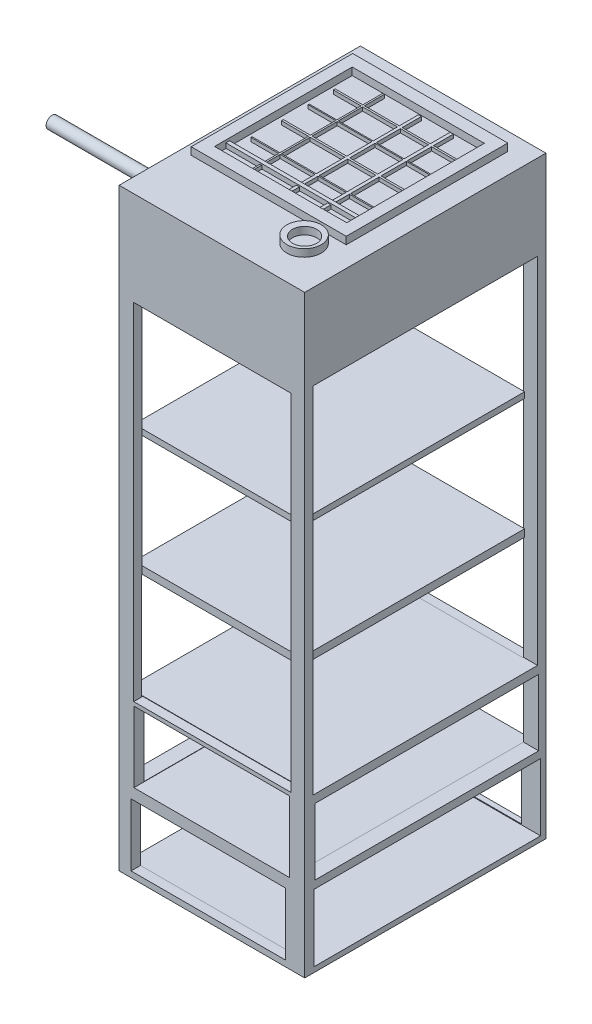
from build123d import *

# Parameters (mm, degrees)
SKETCH1_W            = 65
SKETCH1_H            = 160
SKETCH1_W_2          = 60.528038534
SKETCH1_H_2          = 95.484432758
BOSS_EXTRUDE1_DEPTH  = 50
SKETCH2_W            = 42.326088174
SKETCH2_H            = 93.155548253
CUT_EXTRUDE1_DEPTH   = 122.249667031
BOSS_EXTRUDE2_REACH  = 134.687
SKETCH3_W            = 45.057465339
SKETCH3_H            = 60.150971425
SKETCH4_W            = 60.381733109
SKETCH4_H            = 32.891934871
CUT_EXTRUDE2_DEPTH   = 107.656068998
SKETCH5_W            = 60.382912929
SKETCH5_H            = 30.398575893
CUT_EXTRUDE3_DEPTH   = 106.874612869
SKETCH6_W            = 60.450333047
SKETCH6_H            = 28.299971804
CUT_EXTRUDE4_DEPTH   = 106.874612869
SKETCH7_W            = 60.304182419
SKETCH7_H            = 17.866945613
CUT_EXTRUDE5_DEPTH   = 108.390557105
SKETCH8_W            = 41.938013728
SKETCH8_H            = 19.050379348
CUT_EXTRUDE6_DEPTH   = 122.249667031
SKETCH10_W           = 61.039483095
SKETCH10_H           = 18.053937432
CUT_EXTRUDE10_DEPTH  = 108.390557105
SKETCH11_W           = 41.646222101
SKETCH11_H           = 16.821762484
CUT_EXTRUDE11_DEPTH  = 122.249667031
SKETCH12_W           = 49.589952093
SKETCH12_H           = 16.631512911
SKETCH12_W_2         = 47.300181513
SKETCH12_H_2         = 13.851244047
BOSS_EXTRUDE3_DEPTH  = 1
SKETCH13_W           = 45.839716171
SKETCH13_H           = 0.890318649
SKETCH13_W_2         = 45.905024831
SKETCH13_H_2         = 1.282340891
SKETCH13_W_3         = 45.845114803
SKETCH13_H_3         = 0.974971816
SKETCH13_W_4         = 45.731578188
SKETCH13_H_4         = 0.863681621
SKETCH13_W_5         = 45.697874722
SKETCH13_H_5         = 1.122034321
SKETCH13_W_6         = 45.509061355
SKETCH13_H_6         = 0.794799146
SKETCH13_W_7         = 45.326574904
SKETCH13_H_7         = 0.794799147
BOSS_EXTRUDE4_DEPTH  = 1
SKETCH17_R           = 1.607820768
BOSS_EXTRUDE7_DEPTH  = 28
SKETCH18_W           = 10.937487341
SKETCH18_H           = 16.621028589
BOSS_EXTRUDE9_DEPTH  = 10
SKETCH19_R           = 4.627107614
SKETCH19_R_2         = 3.270039979
BOSS_EXTRUDE10_DEPTH = 2
SKETCH20_W           = 41.780348976
SKETCH20_H           = 43.518942413
SKETCH20_W_2         = 35.604050516
SKETCH20_H_2         = 37.085631452
BOSS_EXTRUDE11_DEPTH = 2
SKETCH21_W           = 32.887722397
SKETCH21_H           = 0.487135297
SKETCH21_W_2         = 32.813642609
SKETCH21_H_2         = 0.298891609
SKETCH21_W_3         = 33.103909687
SKETCH21_H_3         = 0.519356465
SKETCH21_W_4         = 32.881457599
SKETCH21_H_4         = 0.334671964
BOSS_EXTRUDE12_DEPTH = 1
SKETCH22_W           = 0.874446188
SKETCH22_H           = 35.620818237
SKETCH22_W_2         = 0.798521822
SKETCH22_H_2         = 35.450784603
SKETCH22_W_3         = 0.430258013
SKETCH22_H_3         = 35.676845905
BOSS_EXTRUDE13_DEPTH = 1
SKETCH23_W           = 0.99539846
SKETCH23_H           = 1.272922131
BOSS_EXTRUDE14_DEPTH = 37


with BuildPart() as part:
    # Sketch1 → Boss-Extrude1 (new body)
    with BuildSketch(Plane(origin=(0, 0, 0), x_dir=(0, 0, -1), z_dir=(1, 0, 0))):
        with Locations((0, -9.311151349)):
            Rectangle(SKETCH1_W, SKETCH1_H)
        Rectangle(SKETCH1_W_2, SKETCH1_H_2, mode=Mode.SUBTRACT)
    extrude(amount=BOSS_EXTRUDE1_DEPTH)

    # Sketch2 → Cut-Extrude1 (cut, through all)
    with BuildSketch(Plane(origin=(0, 0, -32.5), x_dir=(-1, 0, 0), z_dir=(0, 0, -1))):
        with Locations((-25.089374091, -1.26406407)):
            Rectangle(SKETCH2_W, SKETCH2_H)
    extrude(amount=-CUT_EXTRUDE1_DEPTH, mode=Mode.SUBTRACT)

    # Sketch3 → Boss-Extrude2 (add, up to next)
    with BuildSketch(Plane(origin=(0, -47.841838197, 0), x_dir=(1, 0, 0), z_dir=(0, 1, 0)), mode=Mode.PRIVATE) as boss_extrude2_sk1:
        with Locations((24.126405258, 0.015150235)):
            Rectangle(SKETCH3_W, SKETCH3_H)
    boss_extrude2_tool1 = extrude(boss_extrude2_sk1.sketch, amount=BOSS_EXTRUDE2_REACH, mode=Mode.PRIVATE) - part.part
    add(boss_extrude2_tool1.solids().sort_by_distance((24.126405, -47.841838, -0.01515))[0])

    # Sketch4 → Cut-Extrude2 (cut, through all)
    with BuildSketch(Plane.ZY.offset(-1.597672588)):
        with Locations((0.073152713, 30.976902972)):
            Rectangle(SKETCH4_W, SKETCH4_H)
    extrude(amount=-CUT_EXTRUDE2_DEPTH, mode=Mode.SUBTRACT)

    # Sketch5 → Cut-Extrude3 (cut, through all)
    with BuildSketch(Plane(origin=(46.655137927, 0, 0), x_dir=(0, 0, -1), z_dir=(1, 0, 0))):
        with Locations((0.015748322, -2.242863916)):
            Rectangle(SKETCH5_W, SKETCH5_H)
    extrude(amount=-CUT_EXTRUDE3_DEPTH, mode=Mode.SUBTRACT)


with BuildPart() as cut_extrude3_piece_1:
    # of the separate pieces the step leaves, piece 1, a body of its own (cut_extrude3_pieces)
    add(part.part.solids().sort_by_distance((0, 70.688848651, 32.5))[0])

    # Sketch6 → Cut-Extrude4 (cut, through all)
    with BuildSketch(Plane(origin=(46.655137927, 0, 0), x_dir=(0, 0, -1), z_dir=(1, 0, 0))):
        with Locations((-0.134530576, -33.592230477)):
            Rectangle(SKETCH6_W, SKETCH6_H)
    extrude(amount=-CUT_EXTRUDE4_DEPTH, mode=Mode.SUBTRACT)


with BuildPart() as cut_extrude3_piece_2:
    # of the separate pieces the step leaves, piece 2, a body of its own (cut_extrude3_pieces)
    add(part.part.solids().sort_by_distance((1.597672588, 12.95642403, 30.060335478))[0])


with BuildPart() as cut_extrude4_piece_1:
    # of the separate pieces the step leaves, piece 1, a body of its own (cut_extrude4_pieces)
    add(cut_extrude3_piece_1.part.solids().sort_by_distance((0, 70.688848651, 32.5))[0])

    # Sketch7 → Cut-Extrude5 (cut, through all)
    with BuildSketch(Plane(origin=(50, 0, 0), x_dir=(0, 0, -1), z_dir=(1, 0, 0))):
        with Locations((0.408649334, -58.901640668)):
            Rectangle(SKETCH7_W, SKETCH7_H)
    extrude(amount=-CUT_EXTRUDE5_DEPTH, mode=Mode.SUBTRACT)

    # Sketch8 → Cut-Extrude6 (cut, through all)
    with BuildSketch(Plane.XY.offset(32.5)):
        with Locations((24.937685037, -58.391714518)):
            Rectangle(SKETCH8_W, SKETCH8_H)
    extrude(amount=-CUT_EXTRUDE6_DEPTH, mode=Mode.SUBTRACT)

    # Sketch10 → Cut-Extrude10 (cut, through all)
    with BuildSketch(Plane(origin=(50, 0, 0), x_dir=(0, 0, -1), z_dir=(1, 0, 0))):
        with Locations((0.549643151, -78.905058677)):
            Rectangle(SKETCH10_W, SKETCH10_H)
    extrude(amount=-CUT_EXTRUDE10_DEPTH, mode=Mode.SUBTRACT)

    # Sketch11 → Cut-Extrude11 (cut, through all)
    with BuildSketch(Plane(origin=(0, 0, -32.5), x_dir=(-1, 0, 0), z_dir=(0, 0, -1))):
        with Locations((-24.035895951, -79.303751107)):
            Rectangle(SKETCH11_W, SKETCH11_H)
    extrude(amount=-CUT_EXTRUDE11_DEPTH, mode=Mode.SUBTRACT)

    # Sketch12 → Boss-Extrude3 (add)
    with BuildSketch(Plane.ZY):
        with Locations((-5.492180669, 58.694681273)):
            Rectangle(SKETCH12_W, SKETCH12_H)
        with Locations((-5.525216071, 58.694681273)):
            Rectangle(SKETCH12_W_2, SKETCH12_H_2, mode=Mode.SUBTRACT)
    extrude(amount=BOSS_EXTRUDE3_DEPTH)

    # Sketch13 → Boss-Extrude4 (add)
    with BuildSketch(Plane.ZY):
        with Locations((-5.377717448, 64.290674916)):
            Rectangle(SKETCH13_W, SKETCH13_H)
        with Locations((-5.226691927, 61.86662146)):
            Rectangle(SKETCH13_W_2, SKETCH13_H_2)
        with Locations((-5.248555952, 59.567075524)):
            Rectangle(SKETCH13_W_3, SKETCH13_H_3)
        with Locations((-5.152813679, 57.576559324)):
            Rectangle(SKETCH13_W_4, SKETCH13_H_4)
        with Locations((-5.200029293, 56.166283026)):
            Rectangle(SKETCH13_W_5, SKETCH13_H_5)
        with Locations((-5.19964658, 54.607638312)):
            Rectangle(SKETCH13_W_6, SKETCH13_H_6)
        with Locations((-5.357859681, 53.045682582)):
            Rectangle(SKETCH13_W_7, SKETCH13_H_7)
    extrude(amount=BOSS_EXTRUDE4_DEPTH)

    # Sketch17 → Boss-Extrude7 (add)
    with BuildSketch(Plane.ZY):
        with Locations(Location((22.577485158, 66.459315008, 0), (0, 0, 180))):
            Circle(SKETCH17_R)
    extrude(amount=BOSS_EXTRUDE7_DEPTH)

    # Sketch18 → Boss-Extrude9 (add)
    with BuildSketch(Plane(origin=(0, -67.916904192, 0), x_dir=(1, 0, 0), z_dir=(0, 1, 0))):
        with Locations((13.766644122, 19.989065313)):
            Rectangle(SKETCH18_W, SKETCH18_H)
    extrude(amount=BOSS_EXTRUDE9_DEPTH)

    # Sketch19 → Boss-Extrude10 (add)
    with BuildSketch(Plane(origin=(0, 70.688848651, 0), x_dir=(1, 0, 0), z_dir=(0, 1, 0))):
        with Locations(Location((38.451246114, -21.11254794, 0), (0, 0, 90))):
            Circle(SKETCH19_R)
        with Locations(Location((38.892457452, -21.416438878, 0), (0, 0, 270))):
            Circle(SKETCH19_R_2, mode=Mode.SUBTRACT)
    extrude(amount=BOSS_EXTRUDE10_DEPTH)

    # Sketch20 → Boss-Extrude11 (add)
    with BuildSketch(Plane(origin=(0, 70.688848651, 0), x_dir=(1, 0, 0), z_dir=(0, 1, 0))):
        with Locations((23.605777567, 5.957087191)):
            Rectangle(SKETCH20_W, SKETCH20_H)
        with Locations((23.605777567, 5.957087192)):
            Rectangle(SKETCH20_W_2, SKETCH20_H_2, mode=Mode.SUBTRACT)
    extrude(amount=BOSS_EXTRUDE11_DEPTH)

    # Sketch21 → Boss-Extrude12 (add)
    with BuildSketch(Plane(origin=(0, 70.688848651, 0), x_dir=(1, 0, 0), z_dir=(0, 1, 0))):
        with Locations((24.055333596, 17.85356079)):
            Rectangle(SKETCH21_W, SKETCH21_H)
        with Locations((24.06387224, 10.924440202)):
            Rectangle(SKETCH21_W_2, SKETCH21_H_2)
        with Locations((24.354030658, 3.698069407)):
            Rectangle(SKETCH21_W_3, SKETCH21_H_3)
        with Locations((24.006890393, -4.419498198)):
            Rectangle(SKETCH21_W_4, SKETCH21_H_4)
    extrude(amount=BOSS_EXTRUDE12_DEPTH)

    # Sketch22 → Boss-Extrude13 (add)
    with BuildSketch(Plane(origin=(0, 70.688848651, 0), x_dir=(1, 0, 0), z_dir=(0, 1, 0))):
        with Locations((33.659568231, 5.640223845)):
            Rectangle(SKETCH22_W, SKETCH22_H)
        with Locations((25.271131057, 5.555207028)):
            Rectangle(SKETCH22_W_2, SKETCH22_H_2)
        with Locations((15.282814024, 5.66823768)):
            Rectangle(SKETCH22_W_3, SKETCH22_H_3)
    extrude(amount=BOSS_EXTRUDE13_DEPTH)

    # Sketch23 → Boss-Extrude14 (add)
    with BuildSketch(Plane.ZY.offset(-41.407802825)):
        with Locations((9.070972774, 71.395610402)):
            Rectangle(SKETCH23_W, SKETCH23_H)
    extrude(amount=BOSS_EXTRUDE14_DEPTH)


with BuildPart() as cut_extrude4_piece_2:
    # of the separate pieces the step leaves, piece 2, a body of its own (cut_extrude4_pieces)
    add(cut_extrude3_piece_1.part.solids().sort_by_distance((46.655137927, -19.442244575, -30.090635947))[0])


solid = Compound([cut_extrude3_piece_2.part, cut_extrude4_piece_1.part, cut_extrude4_piece_2.part])
